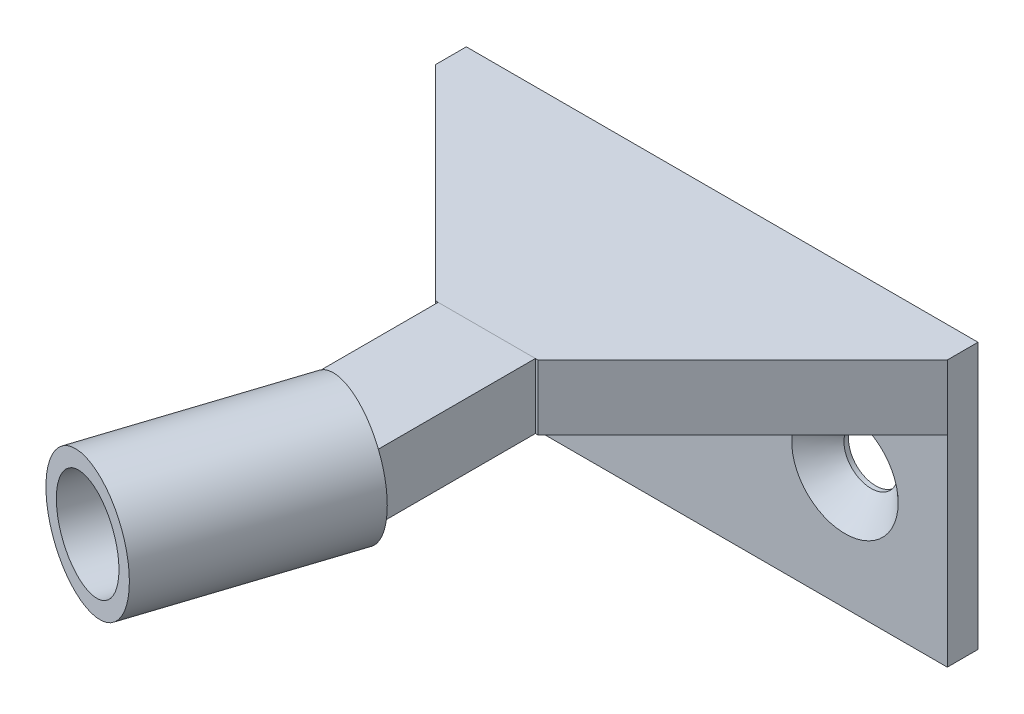
from build123d import *

# Parameters (mm, degrees)
BASE_W                                          = 50
BASE_H                                          = 26
BOSS_EXTRUDE2_DEPTH                             = 3
SKETCH2_R                                       = 6.35
BOSS_EXTRUDE1_DEPTH                             = 20
SKETCH7_R                                       = 4.7625
CUT_EXTRUDE1_DEPTH                              = 15
BOSS_EXTRUDE8_REACH                             = 47.531
CSK_FOR_M5_FLAT_HEAD_MACHINE_SCREW2_D           = 5.3
CSK_FOR_M5_FLAT_HEAD_MACHINE_SCREW2_DEPTH       = 10
CSK_FOR_M5_FLAT_HEAD_MACHINE_SCREW2_CSINK_D     = 10.4
CSK_FOR_M5_FLAT_HEAD_MACHINE_SCREW2_CSINK_ANGLE = 90
CSK_FOR_M5_FLAT_HEAD_MACHINE_SCREW2_TIP         = 1.59228064


with BuildPart() as part:
    # Base → Boss-Extrude2 (new body)
    with BuildSketch(Plane.XY):
        Rectangle(BASE_W, BASE_H)
    extrude(amount=BOSS_EXTRUDE2_DEPTH)

    # Sketch6 → Loft2 section 0
    with BuildSketch(Plane.XY.offset(23)):
        with BuildLine():
            Line((-5, 13), (5, 13))
            Line((5, 13), (5, 6.65))
            Line((5, 6.65), (-5, 6.65))
            Line((-5, 6.65), (-5, 13))
        make_face()
    # Sketch5 → Loft2 section 1
    with BuildSketch(Plane.XY.offset(3)):
        with BuildLine():
            Line((-25, 13), (25, 13))
            Line((25, 13), (25, 6.65))
            Line((25, 6.65), (-25, 6.65))
            Line((-25, 6.65), (-25, 13))
        make_face()
    loft()



with BuildPart() as body_2:
    # Sketch2 → Boss-Extrude1 (new body)
    with BuildSketch(Plane(origin=(-16.995934691, 0, 52.308108396), x_dir=(0.9510565162951523, 0, 0.3090169943749514), z_dir=(-0.3090169943749514, 0, 0.9510565162951523))):
        with Locations((11.371412907, 9.08)):
            Circle(SKETCH2_R)
    extrude(amount=-BOSS_EXTRUDE1_DEPTH)

    # Sketch7 → Cut-Extrude1 (cut)
    with BuildSketch(Plane(origin=(-16.995934691, 0, 52.308108396), x_dir=(0.9510565162951523, 0, 0.3090169943749514), z_dir=(-0.3090169943749514, 0, 0.9510565162951523))):
        with Locations((11.371412907, 9.08)):
            Circle(SKETCH7_R)
    extrude(amount=-CUT_EXTRUDE1_DEPTH, mode=Mode.SUBTRACT)


with BuildPart() as part_1:
    add(part.part)

    add(body_2.part)  # Boss-Extrude8 merges body 2
    # Boss-Extrude8: up to this plane
    boss_extrude8_end = Plane(origin=(-0.000738458, 9.08, 36.800937909), z_dir=(-0.3090169943749514, 0, 0.9510565162951523))
    # Sketch17 → Boss-Extrude8 (add, up to the surface)
    with BuildSketch(Plane.XY.offset(23), mode=Mode.PRIVATE) as boss_extrude8_sk1:
        Polygon((-4.751504294, 13.000455244), (-4.751504294, 6.647086382), (4.750367151, 6.647086382), (4.750367151, 13), align=None)
    boss_extrude8_tool1 = split(extrude(boss_extrude8_sk1.sketch, amount=BOSS_EXTRUDE8_REACH, mode=Mode.PRIVATE), bisect_by=boss_extrude8_end, keep=Keep.BOTH, mode=Mode.PRIVATE)
    add(boss_extrude8_tool1.solids().sort_by_distance((-0.000625, 9.823657, 23))[0])

    # CSK for M5 Flat Head Machine Screw2
    with Locations(Plane.XY.offset(3)):
        with Locations((-15, -1.5), (15, -1.5)):
            CounterSinkHole(CSK_FOR_M5_FLAT_HEAD_MACHINE_SCREW2_D / 2, CSK_FOR_M5_FLAT_HEAD_MACHINE_SCREW2_CSINK_D / 2, depth=CSK_FOR_M5_FLAT_HEAD_MACHINE_SCREW2_DEPTH, counter_sink_angle=CSK_FOR_M5_FLAT_HEAD_MACHINE_SCREW2_CSINK_ANGLE)
            with Locations((0, 0, -(CSK_FOR_M5_FLAT_HEAD_MACHINE_SCREW2_DEPTH + CSK_FOR_M5_FLAT_HEAD_MACHINE_SCREW2_TIP / 2))):  # 118° drill point
                Cone(0, CSK_FOR_M5_FLAT_HEAD_MACHINE_SCREW2_D / 2, CSK_FOR_M5_FLAT_HEAD_MACHINE_SCREW2_TIP, mode=Mode.SUBTRACT)


solid = part_1.part
